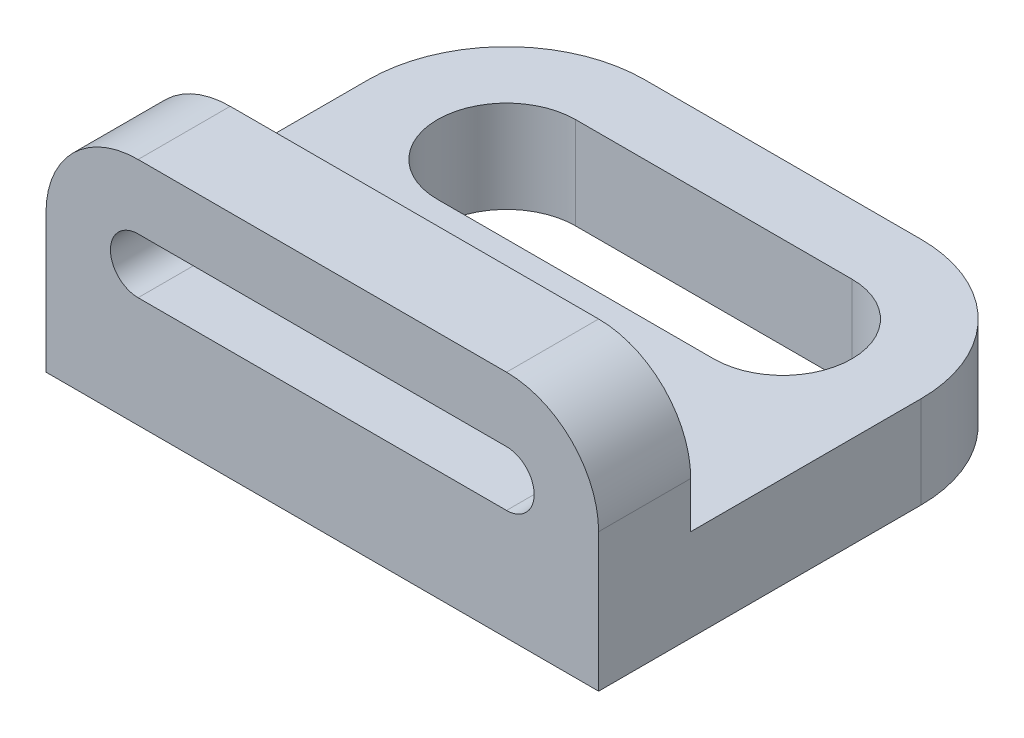
from build123d import *

# Parameters (mm, degrees)
BOSS_EXTRUDE2_DEPTH = 120
CUT_EXTRUDE1_DEPTH  = 160.059737206
FILLET1_R           = 30
FILLET2_R           = 30
FILLET3_R           = 20
CUT_EXTRUDE2_DEPTH  = 153.643375225


with BuildPart() as part:
    # Sketch3 → Boss-Extrude2 (new body)
    with BuildSketch(Plane(origin=(0, 0, 0), x_dir=(0, 0, -1), z_dir=(1, 0, 0))):
        Polygon((0, 0), (100, 0), (100, 20), (20, 20), (20, 50), (0, 50), align=None)
    extrude(amount=BOSS_EXTRUDE2_DEPTH)

    # Sketch4 → Cut-Extrude1 (cut, through all)
    with BuildSketch(Plane(origin=(0, 20, 0), x_dir=(1, 0, 0), z_dir=(0, 1, 0))):
        with BuildLine():
            Line((30, 85), (90, 85))
            ThreePointArc((90, 85), (105, 70), (90, 55))
            Line((90, 55), (30, 55))
            ThreePointArc((30, 55), (15, 70), (30, 85))
        make_face()
    extrude(amount=-CUT_EXTRUDE1_DEPTH, mode=Mode.SUBTRACT)

    # Fillet1
    fillet1_edges = [part.edges().sort_by_distance(p)[0] for p in [
        (0, 10, -100),
    ]]
    fillet(fillet1_edges, radius=FILLET1_R)

    # Fillet2
    fillet2_edges = [part.edges().sort_by_distance(p)[0] for p in [
        (120, 10, -100),
    ]]
    fillet(fillet2_edges, radius=FILLET2_R)

    # Fillet3
    fillet3_edges = [part.edges().sort_by_distance(p)[0] for p in [
        (120, 50, -10),
        (0, 50, -10),
    ]]
    fillet(fillet3_edges, radius=FILLET3_R)

    # Sketch7 → Cut-Extrude2 (cut, through all)
    with BuildSketch(Plane(origin=(0, 0, -20), x_dir=(-1, 0, 0), z_dir=(0, 0, -1))):
        with BuildLine():
            Line((-20, 24), (-100, 24))
            ThreePointArc((-100, 24), (-106, 30), (-100, 36))
            Line((-100, 36), (-20, 36))
            ThreePointArc((-20, 36), (-14, 30), (-20, 24))
        make_face()
    extrude(amount=-CUT_EXTRUDE2_DEPTH, mode=Mode.SUBTRACT)


solid = part.part
